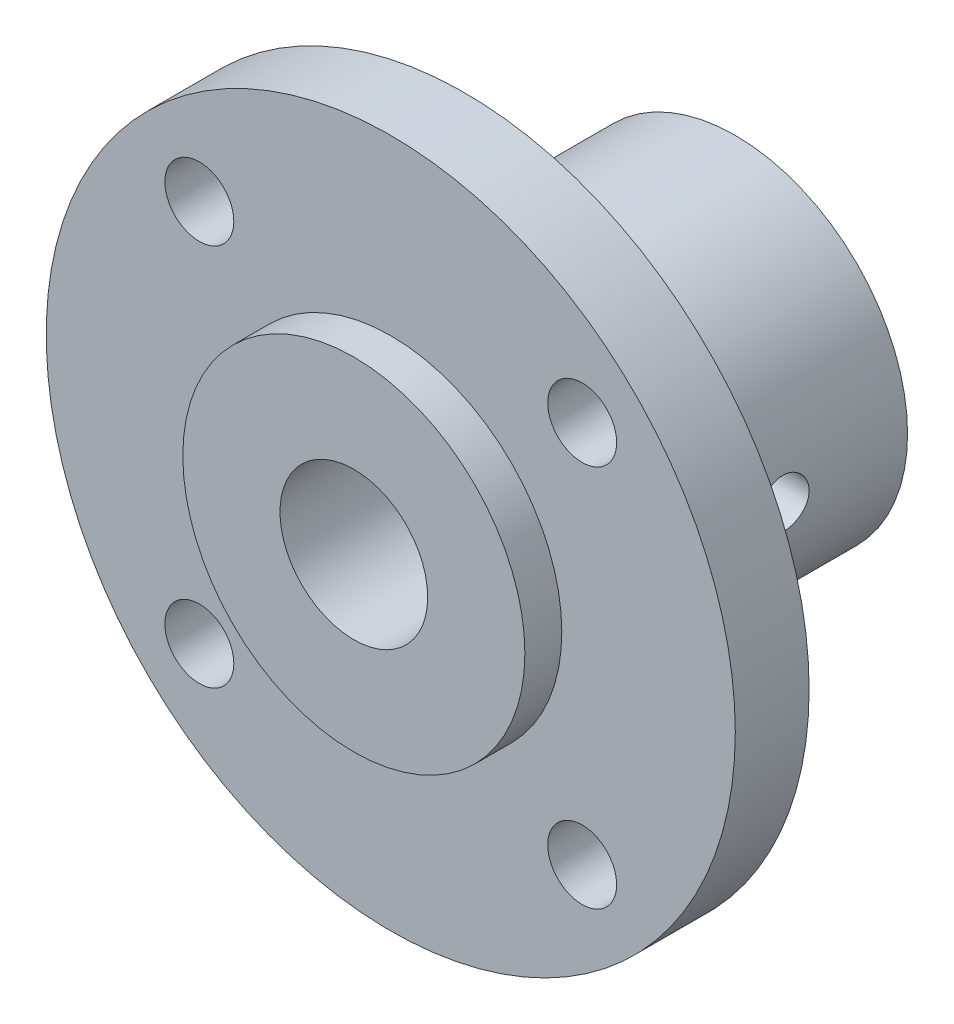
from build123d import *

# Parameters (mm, degrees)
SKETCH1_R                            = 14
BOSS_EXTRUDE1_DEPTH                  = 3
SKETCH2_R                            = 6.95
BOSS_EXTRUDE2_DEPTH                  = 1.5
SKETCH3_R                            = 3
CUT_EXTRUDE1_DEPTH                   = 21.303940504
SKETCH4_R                            = 7
SKETCH4_R_2                          = 3
SHAFT_HUB_COLLAR_L11_DEPTH           = 11
SKETCH5_R                            = 1.4
FLANGE_FOUR_D2P8_PCD22_DEPTH         = 3.01
DIN1481_D2_CROSS_PIN_HOLE_DEPTH      = 23.649503306
DIN1481_D2_CROSS_PIN_HOLE_DEPTH_BACK = 23.649503306
SKETCH6_R                            = 1


with BuildPart() as part:
    # Sketch1 → Boss-Extrude1 (new body)
    with BuildSketch(Plane.XY):
        Circle(SKETCH1_R)
    extrude(amount=BOSS_EXTRUDE1_DEPTH)

    # Sketch2 → Boss-Extrude2 (add)
    with BuildSketch(Plane.XY.offset(3)):
        Circle(SKETCH2_R)
    extrude(amount=BOSS_EXTRUDE2_DEPTH)

    # Sketch3 → Cut-Extrude1 (cut, through all)
    with BuildSketch(Plane.XY.offset(4.5)):
        Circle(SKETCH3_R)
    extrude(amount=-CUT_EXTRUDE1_DEPTH, mode=Mode.SUBTRACT)

    # Sketch4 → Shaft_Hub_Collar_L11 (add)
    with BuildSketch(Plane.XY):
        Circle(SKETCH4_R)
        Circle(SKETCH4_R_2, mode=Mode.SUBTRACT)
    extrude(amount=-SHAFT_HUB_COLLAR_L11_DEPTH)

    # Sketch5 → Flange_Four_D2p8_PCD22 (cut)
    with BuildSketch(Plane(origin=(0, 0, 0), x_dir=(-1, 0, 0), z_dir=(0, 0, -1))):
        with Locations((-7.778174593, 7.778174593)):
            Circle(SKETCH5_R)
        with Locations((7.778174593, 7.778174593)):
            Circle(SKETCH5_R)
        with Locations((7.778174593, -7.778174593)):
            Circle(SKETCH5_R)
        with Locations((-7.778174593, -7.778174593)):
            Circle(SKETCH5_R)
    extrude(amount=-FLANGE_FOUR_D2P8_PCD22_DEPTH, mode=Mode.SUBTRACT)

    # Sketch6 → DIN1481_D2_Cross_Pin_Hole (cut, two sides: drawn at the far end of the back side and taken through both)
    with BuildSketch(Plane(origin=(0, 0, 0), x_dir=(0, 0, -1), z_dir=(1, 0, 0)).offset(-DIN1481_D2_CROSS_PIN_HOLE_DEPTH_BACK)):
        with Locations((6, 0)):
            Circle(SKETCH6_R)
    extrude(amount=DIN1481_D2_CROSS_PIN_HOLE_DEPTH + DIN1481_D2_CROSS_PIN_HOLE_DEPTH_BACK, mode=Mode.SUBTRACT)


solid = part.part
